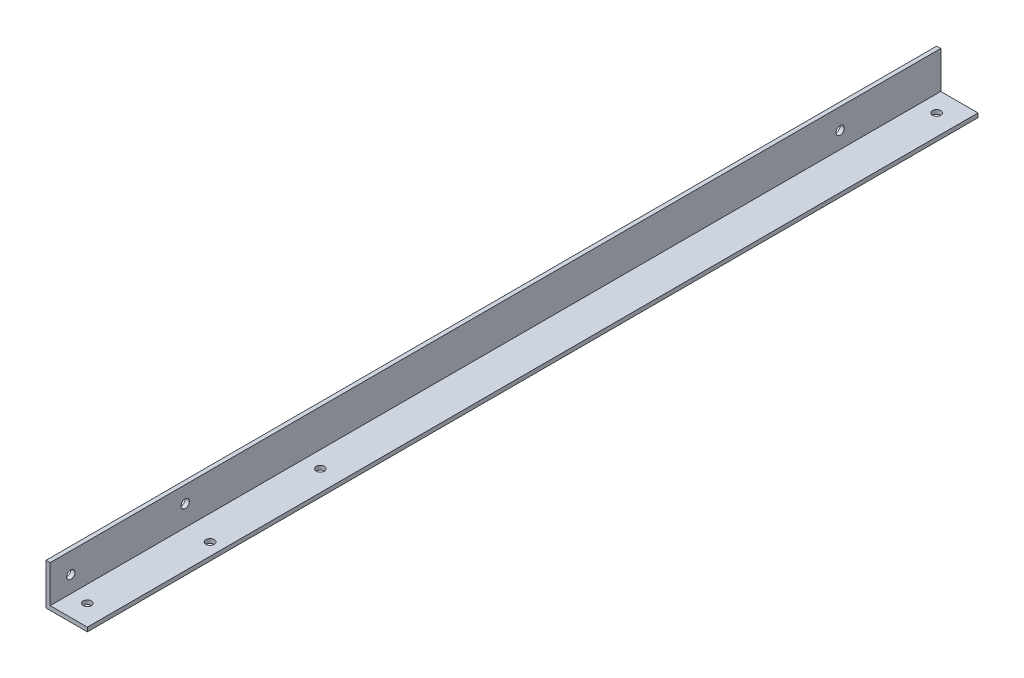
from build123d import *

# Parameters (mm, degrees)
EXTRUSION1_DEPTH = 323
ESQUISSE2_R      = 1.5
EXTRUSION2_DEPTH = 248
ESQUISSE3_R      = 1.5
EXTRUSION3_DEPTH = 248


with BuildPart() as part:
    # Esquisse1 → Extrusion1 (new body)
    with BuildSketch(Plane.XY):
        Polygon((-20.61337059, 2.046), (-20.61337059, -12.954), (-5.61337059, -12.954), (-5.61337059, -11.454), (-19.11337059, -11.454), (-19.11337059, 2.046), align=None)
    extrude(amount=EXTRUSION1_DEPTH)

    # Esquisse2 → Extrusion2 (cut)
    with BuildSketch(Plane(origin=(0, -11.454, 0), x_dir=(-1, 0, 0), z_dir=(0, 1, 0))):
        with Locations((13.11337059, 7.5)):
            Circle(ESQUISSE2_R)
        with Locations((10.11337059, 274)):
            Circle(ESQUISSE2_R)
        with Locations((13.11337059, 315.5)):
            Circle(ESQUISSE2_R)
        with Locations((13.11337059, 231)):
            Circle(ESQUISSE2_R)
    extrude(amount=-EXTRUSION2_DEPTH, mode=Mode.SUBTRACT)

    # Esquisse3 → Extrusion3 (cut)
    with BuildSketch(Plane(origin=(-19.11337059, 0, 0), x_dir=(0, 0, -1), z_dir=(1, 0, 0))):
        with Locations((-36.5, -5.454)):
            Circle(ESQUISSE3_R)
        with Locations((-274, -3.954)):
            Circle(ESQUISSE3_R)
        with Locations((-315.5, -5.454)):
            Circle(ESQUISSE3_R)
    extrude(amount=-EXTRUSION3_DEPTH, mode=Mode.SUBTRACT)


solid = part.part
